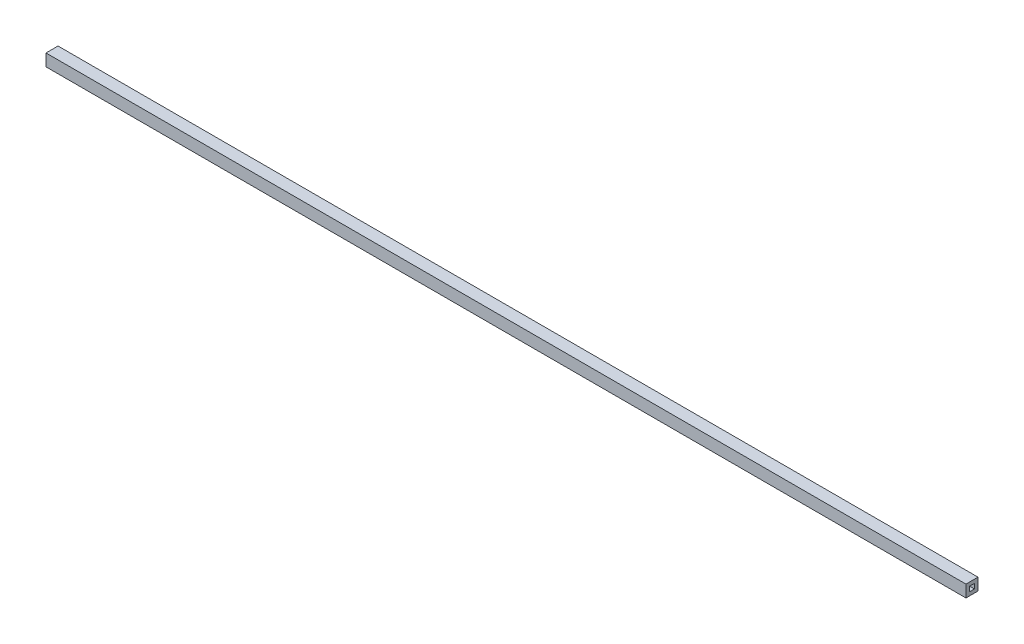
from build123d import *

# Parameters (mm, degrees)
SKETCH1_W           = 5
SKETCH1_H           = 5
SKETCH1_W_2         = 2
SKETCH1_H_2         = 2
BOSS_EXTRUDE1_DEPTH = 382


with BuildPart() as part:
    # Sketch1 → Boss-Extrude1 (new body)
    with BuildSketch(Plane(origin=(0, 0, 0), x_dir=(0, 0, -1), z_dir=(1, 0, 0))):
        Rectangle(SKETCH1_W, SKETCH1_H)
        Rectangle(SKETCH1_W_2, SKETCH1_H_2, mode=Mode.SUBTRACT)
    extrude(amount=BOSS_EXTRUDE1_DEPTH)


solid = part.part
